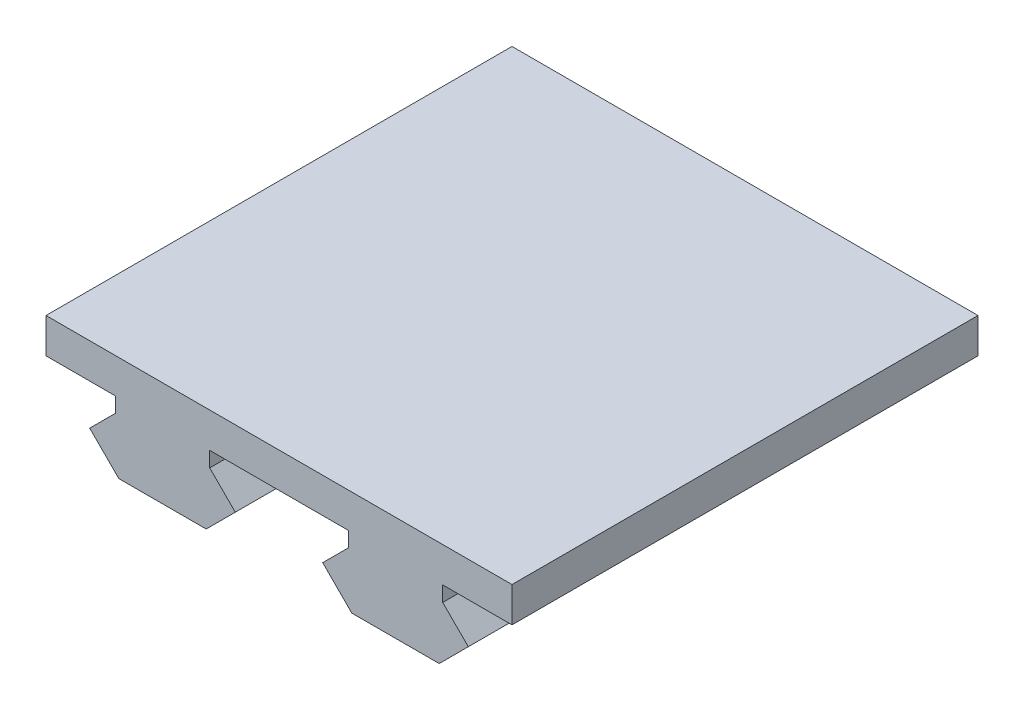
from build123d import *

# Parameters (mm, degrees)
SKETCH1_W           = 40
SKETCH1_H           = 40
BOSS_EXTRUDE1_DEPTH = 3
BOSS_EXTRUDE2_DEPTH = 40
SKETCH3_W           = 13.333333334
SKETCH3_H           = 6
CUT_EXTRUDE1_DEPTH  = 29.91366459


with BuildPart() as part:
    # Sketch1 → Boss-Extrude1 (new body)
    with BuildSketch(Plane(origin=(0, 0, 0), x_dir=(1, 0, 0), z_dir=(0, 1, 0))):
        Rectangle(SKETCH1_W, SKETCH1_H)
    extrude(amount=BOSS_EXTRUDE1_DEPTH)

    # Sketch2 → Boss-Extrude2 (add)
    with BuildSketch(Plane.XY.offset(20)):
        Polygon((-13.75, -6), (-6.25, -6), (-3.75, -3.5), (-5.946498308, -1.303501692), (-5.946498308, 0), (-14.053501692, 0), (-14.053501692, -1.303501692), (-16.25, -3.5), align=None)
    boss_extrude2 = extrude(amount=-BOSS_EXTRUDE2_DEPTH)

    # Sketch3 → Cut-Extrude1 (cut, through all)
    with BuildSketch(Plane(origin=(0, 0, 0), x_dir=(0, 0, -1), z_dir=(1, 0, 0))):
        with Locations((0, -3)):
            Rectangle(SKETCH3_W, SKETCH3_H)
    cut_extrude1 = extrude(amount=-CUT_EXTRUDE1_DEPTH, mode=Mode.SUBTRACT)

    # Mirror1: Boss-Extrude2, Cut-Extrude1 across plane
    add(boss_extrude2.mirror(Plane(origin=(0, 0, 0), x_dir=(0, 0, 1), z_dir=(1, 0, 0))))
    add(cut_extrude1.mirror(Plane(origin=(0, 0, 0), x_dir=(0, 0, 1), z_dir=(1, 0, 0))), mode=Mode.SUBTRACT)


solid = part.part
